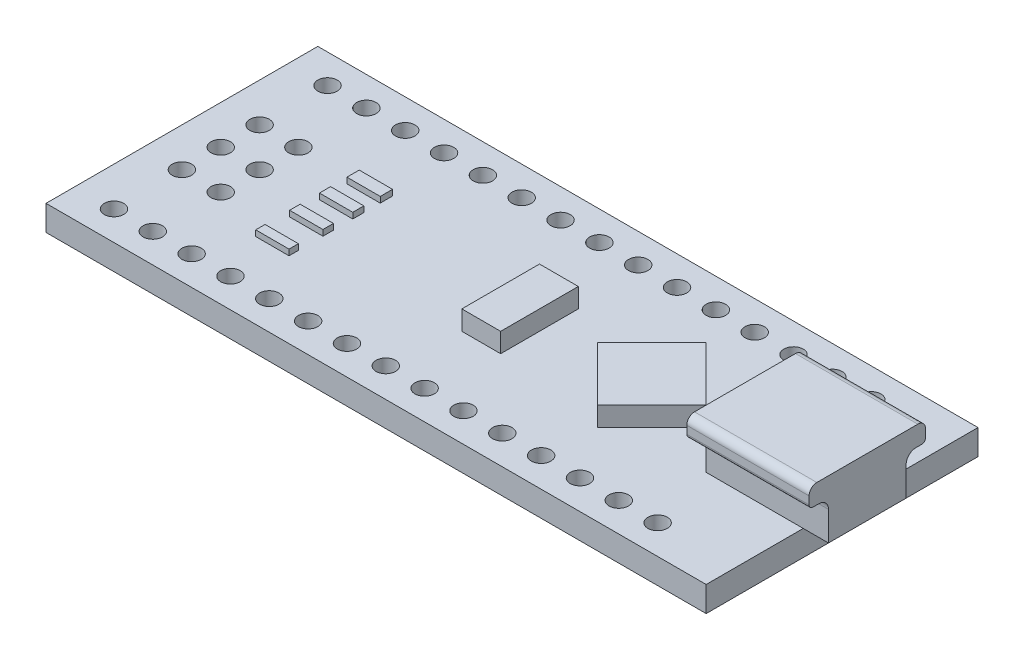
from build123d import *

# Parameters (mm, degrees)
SKETCH1_W                = 43.18
SKETCH1_H                = 17.78
BOSS_EXTRUDE1_DEPTH      = 1.651
SKETCH2_R                = 0.635
CUT_EXTRUDE1_DEPTH       = 47.726508547
BOSS_EXTRUDE2_DEPTH      = 1.651
BOSS_EXTRUDE2_DEPTH_BACK = 6.35
SKETCH4_W                = 2.54
SKETCH4_H                = 5.08
BOSS_EXTRUDE3_DEPTH      = 1.27
SKETCH5_R                = 0.635
CUT_EXTRUDE2_DEPTH       = 49.378332557
SKETCH6_W                = 2.180271617
SKETCH6_H                = 0.803257964
SKETCH6_H_2              = 0.726757206
SKETCH6_H_3              = 0.688506826
SKETCH6_H_4              = 0.612006068
BOSS_EXTRUDE4_DEPTH      = 0.381


with BuildPart() as part:
    # Sketch1 → Boss-Extrude1 (new body)
    with BuildSketch(Plane(origin=(0, 0, 0), x_dir=(1, 0, 0), z_dir=(0, 1, 0))):
        with Locations((21.59, 8.89)):
            Rectangle(SKETCH1_W, SKETCH1_H)
    extrude(amount=BOSS_EXTRUDE1_DEPTH)

    # Sketch2 → Cut-Extrude1 (cut, through all)
    with BuildSketch(Plane(origin=(0, 1.651, 0), x_dir=(1, 0, 0), z_dir=(0, 1, 0))):
        with Locations(Location((2.54, 1.905, 0), (0, 0, 270))):
            Circle(SKETCH2_R)
        with Locations(Location((5.08, 1.905, 0), (0, 0, 270))):
            Circle(SKETCH2_R)
        with Locations(Location((7.62, 1.905, 0), (0, 0, 270))):
            Circle(SKETCH2_R)
        with Locations(Location((10.16, 1.905, 0), (0, 0, 270))):
            Circle(SKETCH2_R)
        with Locations(Location((12.7, 1.905, 0), (0, 0, 270))):
            Circle(SKETCH2_R)
        with Locations(Location((15.24, 1.905, 0), (0, 0, 270))):
            Circle(SKETCH2_R)
        with Locations(Location((17.78, 1.905, 0), (0, 0, 270))):
            Circle(SKETCH2_R)
        with Locations(Location((20.32, 1.905, 0), (0, 0, 270))):
            Circle(SKETCH2_R)
        with Locations(Location((22.86, 1.905, 0), (0, 0, 270))):
            Circle(SKETCH2_R)
        with Locations(Location((25.4, 1.905, 0), (0, 0, 270))):
            Circle(SKETCH2_R)
        with Locations(Location((27.94, 1.905, 0), (0, 0, 270))):
            Circle(SKETCH2_R)
        with Locations(Location((30.48, 1.905, 0), (0, 0, 270))):
            Circle(SKETCH2_R)
        with Locations(Location((33.02, 1.905, 0), (0, 0, 270))):
            Circle(SKETCH2_R)
        with Locations(Location((35.56, 1.905, 0), (0, 0, 270))):
            Circle(SKETCH2_R)
        with Locations(Location((38.1, 1.905, 0), (0, 0, 270))):
            Circle(SKETCH2_R)
        with Locations(Location((38.1, 15.875, 0), (0, 0, 90))):
            Circle(SKETCH2_R)
        with Locations(Location((35.56, 15.875, 0), (0, 0, 90))):
            Circle(SKETCH2_R)
        with Locations(Location((33.02, 15.875, 0), (0, 0, 90))):
            Circle(SKETCH2_R)
        with Locations(Location((30.48, 15.875, 0), (0, 0, 90))):
            Circle(SKETCH2_R)
        with Locations(Location((27.94, 15.875, 0), (0, 0, 90))):
            Circle(SKETCH2_R)
        with Locations(Location((25.4, 15.875, 0), (0, 0, 90))):
            Circle(SKETCH2_R)
        with Locations(Location((22.86, 15.875, 0), (0, 0, 90))):
            Circle(SKETCH2_R)
        with Locations(Location((20.32, 15.875, 0), (0, 0, 90))):
            Circle(SKETCH2_R)
        with Locations(Location((17.78, 15.875, 0), (0, 0, 90))):
            Circle(SKETCH2_R)
        with Locations(Location((15.24, 15.875, 0), (0, 0, 90))):
            Circle(SKETCH2_R)
        with Locations(Location((12.7, 15.875, 0), (0, 0, 90))):
            Circle(SKETCH2_R)
        with Locations(Location((10.16, 15.875, 0), (0, 0, 90))):
            Circle(SKETCH2_R)
        with Locations(Location((7.62, 15.875, 0), (0, 0, 90))):
            Circle(SKETCH2_R)
        with Locations(Location((5.08, 15.875, 0), (0, 0, 90))):
            Circle(SKETCH2_R)
        with Locations(Location((2.54, 15.875, 0), (0, 0, 90))):
            Circle(SKETCH2_R)
    extrude(amount=-CUT_EXTRUDE1_DEPTH, mode=Mode.SUBTRACT)

    # Sketch3 → Boss-Extrude2 (add, two sides: drawn at the far end of the back side and taken through both)
    with BuildSketch(Plane(origin=(43.18, 0, 0), x_dir=(0, 0, -1), z_dir=(1, 0, 0)).offset(-BOSS_EXTRUDE2_DEPTH_BACK)):
        with BuildLine():
            Line((6.35, 1.651), (11.43, 1.651))
            Line((11.43, 1.651), (11.43, 3.556))
            ThreePointArc((11.43, 3.556), (11.615987194, 4.005012806), (12.065, 4.191))
            Line((12.065, 4.191), (12.446, 4.191))
            ThreePointArc((12.446, 4.191), (12.625605122, 4.265394878), (12.7, 4.445))
            Line((12.7, 4.445), (12.7, 4.953))
            ThreePointArc((12.7, 4.953), (12.551210245, 5.312210245), (12.192, 5.461))
            Line((12.192, 5.461), (5.588, 5.461))
            ThreePointArc((5.588, 5.461), (5.228789755, 5.312210245), (5.08, 4.953))
            Line((5.08, 4.953), (5.08, 4.445))
            ThreePointArc((5.08, 4.445), (5.154394878, 4.265394878), (5.334, 4.191))
            Line((5.334, 4.191), (5.715, 4.191))
            ThreePointArc((5.715, 4.191), (6.164012806, 4.005012806), (6.35, 3.556))
            Line((6.35, 3.556), (6.35, 1.651))
        make_face()
    extrude(amount=BOSS_EXTRUDE2_DEPTH + BOSS_EXTRUDE2_DEPTH_BACK)

    # Sketch4 → Boss-Extrude3 (add)
    with BuildSketch(Plane(origin=(0, 1.651, 0), x_dir=(1, 0, 0), z_dir=(0, 1, 0))):
        Polygon((27.198541148, 8.89), (30.744270574, 12.435729426), (34.29, 8.89), (30.744270574, 5.344270574), align=None)
        with Locations((22.118541148, 8.89)):
            Rectangle(SKETCH4_W, SKETCH4_H)
    extrude(amount=BOSS_EXTRUDE3_DEPTH)

    # Sketch5 → Cut-Extrude2 (cut, through all)
    with BuildSketch(Plane(origin=(0, 1.651, 0), x_dir=(1, 0, 0), z_dir=(0, 1, 0))):
        with Locations(Location((2.54, 11.43, 0), (0, 0, 270))):
            Circle(SKETCH5_R)
        with Locations(Location((5.08, 11.43, 0), (0, 0, 270))):
            Circle(SKETCH5_R)
        with Locations(Location((5.08, 8.89, 0), (0, 0, 270))):
            Circle(SKETCH5_R)
        with Locations(Location((2.54, 8.89, 0), (0, 0, 270))):
            Circle(SKETCH5_R)
        with Locations(Location((2.54, 6.35, 0), (0, 0, 270))):
            Circle(SKETCH5_R)
        with Locations(Location((5.08, 6.35, 0), (0, 0, 270))):
            Circle(SKETCH5_R)
    extrude(amount=-CUT_EXTRUDE2_DEPTH, mode=Mode.SUBTRACT)

    # Sketch6 → Boss-Extrude4 (add)
    with BuildSketch(Plane(origin=(0, 1.651, 0), x_dir=(1, 0, 0), z_dir=(0, 1, 0))):
        with Locations((9.83041316, 11.344327099)):
            Rectangle(SKETCH6_W, SKETCH6_H)
        with Locations((9.83041316, 9.508308895)):
            Rectangle(SKETCH6_W, SKETCH6_H_2)
        with Locations((9.83041316, 7.538414363)):
            Rectangle(SKETCH6_W, SKETCH6_H_3)
        with Locations((9.83041316, 5.281641987)):
            Rectangle(SKETCH6_W, SKETCH6_H_4)
    extrude(amount=BOSS_EXTRUDE4_DEPTH)


solid = part.part
